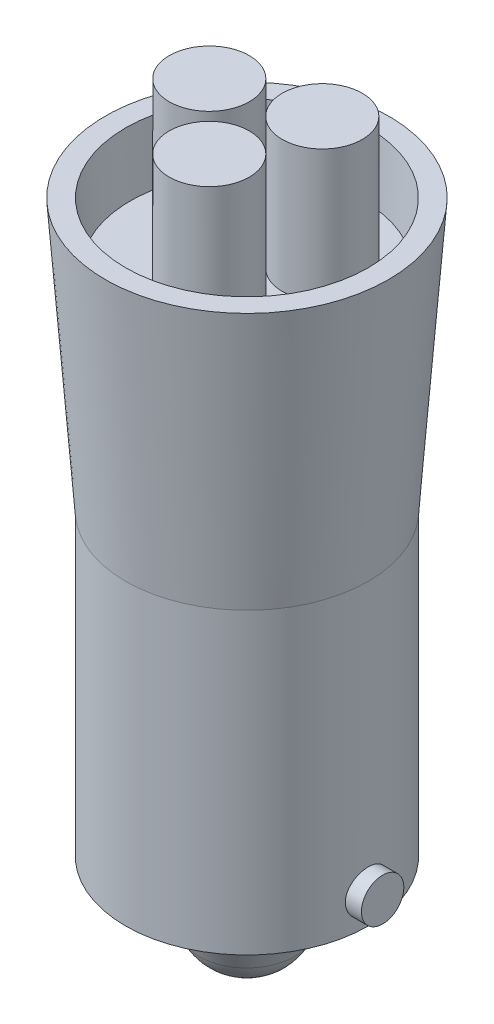
from build123d import *

# Parameters (mm, degrees)
BOSS_EXTRUDE1_DEPTH      = 5.08
BOSS_EXTRUDE1_DEPTH_BACK = 5.08
SKETCH2_R                = 0.79375
SKETCH3_R                = 1.4986
BOSS_EXTRUDE3_DEPTH      = 4.9276


with BuildPart() as part:
    # Sketch1 → Revolve1 (revolve)
    with BuildSketch(Plane.XY):
        with BuildLine():
            Line((0, 0), (0, 22.572427826))
            Line((0, 22.572427826), (4.37022875, 22.572427826))
            Line((4.37022875, 22.572427826), (4.54025, 24.858427826))
            Line((4.54025, 24.858427826), (5.30225, 24.858427826))
            Line((5.30225, 24.858427826), (4.5466, 14.698427826))
            Line((4.5466, 14.698427826), (4.5466, 3.522427826))
            Line((4.5466, 3.522427826), (2.86385, 3.522427826))
            Line((2.86385, 3.522427826), (1.778, 1.143))
            ThreePointArc((1.778, 1.143), (1.056850628, 0.310399023), (0, 0))
        make_face()
    revolve(axis=Axis((0, 0, 0), (0, 1, 0)))

    # Sketch2 → Boss-Extrude1 (add, two sides: drawn at the far end of the back side and taken through both)
    with BuildSketch(Plane(origin=(0, 0, 0), x_dir=(0, 0, -1), z_dir=(1, 0, 0)).offset(-BOSS_EXTRUDE1_DEPTH_BACK)):
        with Locations((0, 4.646377826)):
            Circle(SKETCH2_R)
    extrude(amount=BOSS_EXTRUDE1_DEPTH + BOSS_EXTRUDE1_DEPTH_BACK)

    # Sketch3 → Boss-Extrude3 (add)
    with BuildSketch(Plane(origin=(0, 22.572427826, 0), x_dir=(1, 0, 0), z_dir=(0, 1, 0))):
        with Locations(Location((-1.92644128, 0.516188385, 0), (0, 0, 270))):
            Circle(SKETCH3_R)
        with Locations(Location((1.410252895, 1.410252895, 0), (0, 0, 270))):
            Circle(SKETCH3_R)
        with Locations(Location((0.516188385, -1.92644128, 0), (0, 0, 270))):
            Circle(SKETCH3_R)
    extrude(amount=BOSS_EXTRUDE3_DEPTH)


solid = part.part
